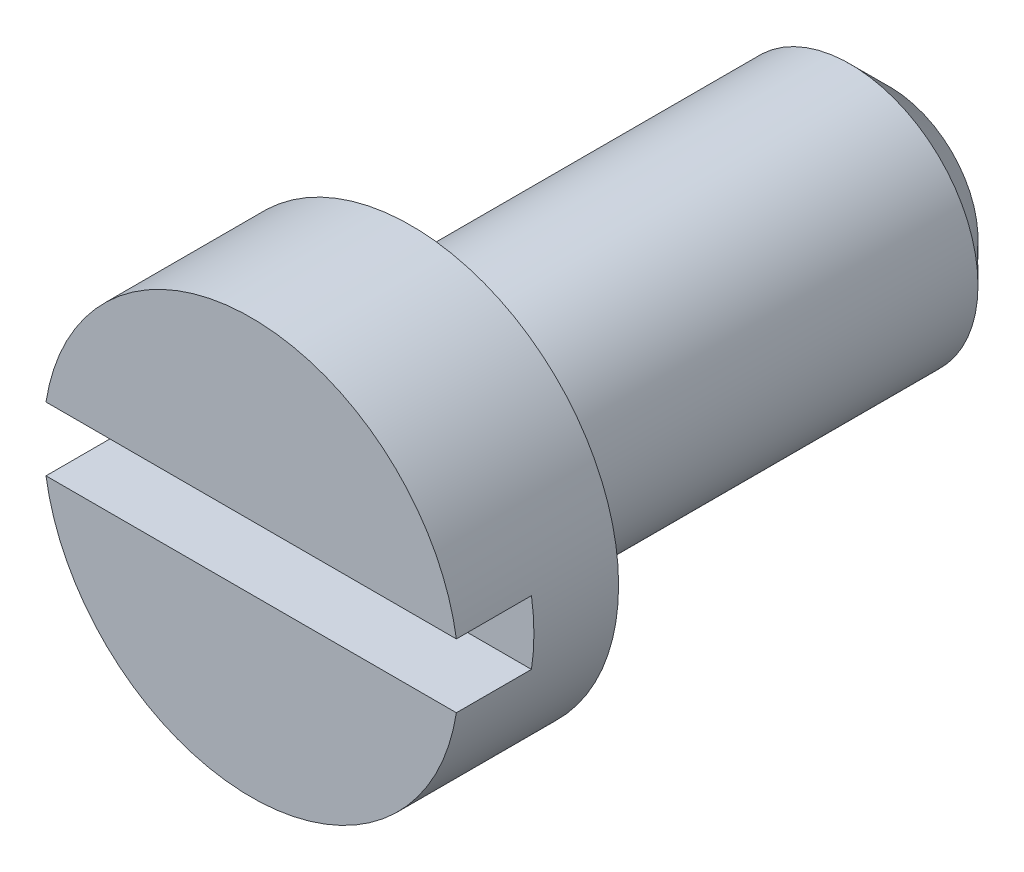
from build123d import *

# Parameters (mm, degrees)
SKETCH_12_R         = 6.5
EXTRUDE_3_DEPTH     = 5
SKETCH_13_R         = 4
EXTRUDE_4_DEPTH     = 15
SKETCH_20_W         = 13.685807656
SKETCH_20_H         = 2
CUT_EXTRUDE_8_DEPTH = 2.35
CHAMFER_1_SIZE      = 1.25


with BuildPart() as part:
    # Эскиз12 → Вытянуть3 (new body)
    with BuildSketch(Plane.XY):
        Circle(SKETCH_12_R)
    extrude(amount=EXTRUDE_3_DEPTH)

    # Эскиз13 → Вытянуть4 (add)
    with BuildSketch(Plane(origin=(0, 0, 0), x_dir=(-1, 0, 0), z_dir=(0, 0, -1))):
        with Locations(Location((0, 0, 0), (0, 0, 180))):
            Circle(SKETCH_13_R)
    extrude(amount=EXTRUDE_4_DEPTH)

    # Эскиз20 → Вырез-Вытянуть8 (cut)
    with BuildSketch(Plane.XY.offset(5)):
        with Locations((0.011126673, 0)):
            Rectangle(SKETCH_20_W, SKETCH_20_H)
    extrude(amount=-CUT_EXTRUDE_8_DEPTH, mode=Mode.SUBTRACT)

    # Фаска1
    chamfer_1_edges = [part.edges().sort_by_distance(p)[0] for p in [
        (-4, 0, -15),
    ]]
    chamfer(chamfer_1_edges, length=CHAMFER_1_SIZE)


solid = part.part
